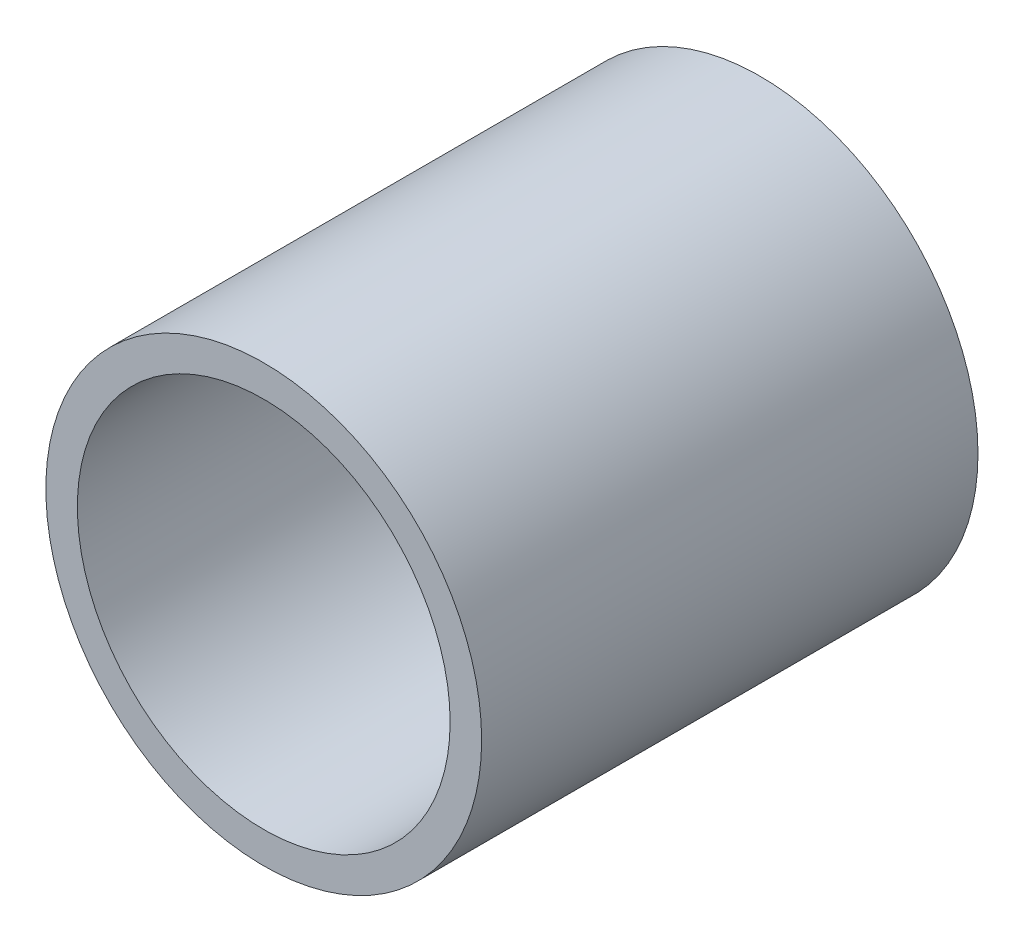
from build123d import *

# Parameters (mm, degrees)
SKETCH1_R           = 11.1506
SKETCH1_R_2         = 9.5377
BOSS_EXTRUDE1_DEPTH = 12.7


with BuildPart() as part:
    # Sketch1 → Boss-Extrude1 (new, symmetric)
    with BuildSketch(Plane.XY):
        Circle(SKETCH1_R)
        Circle(SKETCH1_R_2, mode=Mode.SUBTRACT)
    extrude(amount=BOSS_EXTRUDE1_DEPTH, both=True)


solid = part.part
